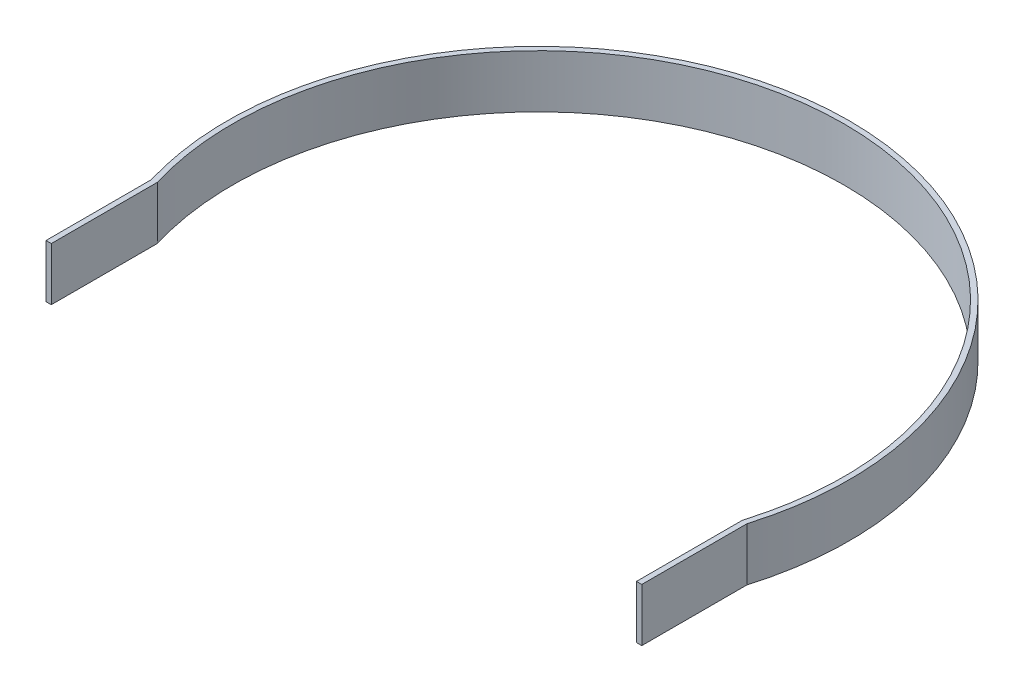
from build123d import *

# Parameters (mm, degrees)
EXTRUDE_THIN1_DEPTH = 5


with BuildPart() as part:
    # Sketch1 → Extrude-Thin1 (new, symmetric)
    with BuildSketch(Plane(origin=(0, 0, 0), x_dir=(1, 0, 0), z_dir=(0, 1, 0))):
        with BuildLine():
            Line((55.2, -36.678710461), (55.2, -16.678710461))
            ThreePointArc((55.2, -16.678710461), (0, 57.664715231), (-55.2, -16.678710461))
            Line((-55.2, -16.678710461), (-55.2, -36.678710461))
            Line((-55.2, -36.678710461), (-56.2, -36.678710461))
            Line((-56.2, -36.678710461), (-56.2, -16.825837665))
            ThreePointArc((-56.2, -16.825837665), (0, 58.664715231), (56.2, -16.825837665))
            Line((56.2, -16.825837665), (56.2, -36.678710461))
            Line((56.2, -36.678710461), (55.2, -36.678710461))
        make_face()
    extrude(amount=EXTRUDE_THIN1_DEPTH, both=True)


solid = part.part
